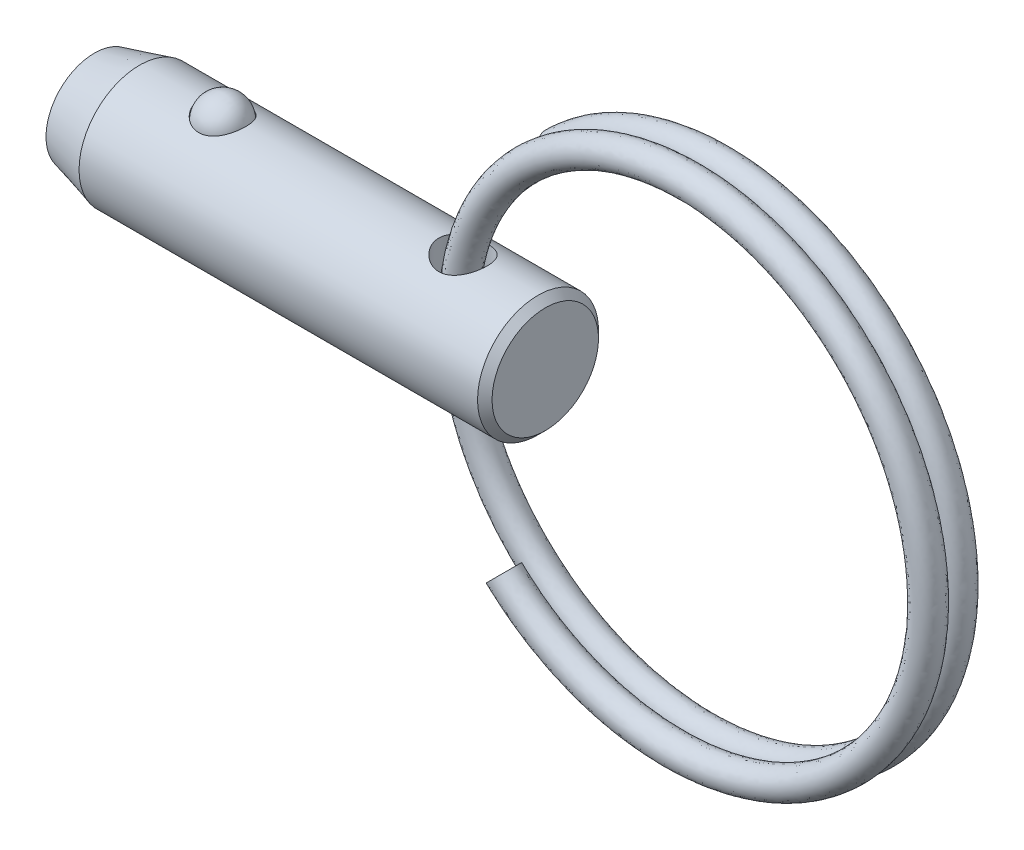
from build123d import *

# Parameters (mm, degrees)
SKETCH4_W          = 1.27
SKETCH4_H          = 6.35
SWEEP1_PITCH       = 1.5494
SWEEP1_HEIGHT      = 1.355725
SWEEP1_RADIUS      = 13.462
SKETCH6_R          = 0.762
SWEEP2_PITCH       = 1.5494
SWEEP2_HEIGHT      = 1.355725
SWEEP2_RADIUS      = 13.462
SWEEP2_START_ANGLE = -180
SKETCH6_2_R        = 0.762


with BuildPart() as part:
    # Sketch1 → Revolve1 (revolve)
    with BuildSketch(Plane.XY, mode=Mode.PRIVATE) as revolve1_sk:
        Polygon((11.8364, 2.794), (11.4554, 3.175), (-9.466547737, 3.175), (-11.8364, 2.54), (-11.8364, 0), (11.8364, 0), align=None)
    revolve(revolve1_sk.sketch.rotate(Axis((11.8364, 0, 0), (1, 0, 0)), 90), axis=Axis((11.8364, 0, 0), (1, 0, 0)))

    # Sketch2 → Cut-Revolve1 (revolve, cut)
    with BuildSketch(Plane.XY):
        with BuildLine():
            Line((-3.844582051, 2.8575), (-6.359182051, 2.8575))
            ThreePointArc((-6.359182051, 2.8575), (-5.101882051, 4.1148), (-3.844582051, 2.8575))
        make_face()
    revolve(axis=Axis((-3.844582051, 2.8575, 0), (1, 0, 0)), mode=Mode.SUBTRACT)

    # Sketch4 → Cut-Revolve2 (revolve, cut)
    with BuildSketch(Plane.XY, mode=Mode.PRIVATE) as cut_revolve2_sk:
        with Locations((8.1534, 0)):
            Rectangle(SKETCH4_W, SKETCH4_H)
    revolve(cut_revolve2_sk.sketch.rotate(Axis((7.5184, -3.175, 0), (0, 1, 0)), 90), axis=Axis((7.5184, -3.175, 0), (0, 1, 0)), mode=Mode.SUBTRACT)


with BuildPart() as body_2:
    # Sketch3 → Revolve2 (revolve)
    with BuildSketch(Plane.XY):
        with BuildLine():
            Line((-3.869982051, 2.8575), (-6.333782051, 2.8575))
            ThreePointArc((-6.333782051, 2.8575), (-5.101882051, 4.0894), (-3.869982051, 2.8575))
        make_face()
    revolve(axis=Axis((-3.869982051, 2.8575, 0), (1, 0, 0)))


with BuildPart() as body_3:
    # Sweep1: sweep along a helix
    with BuildLine() as sweep1_path:
        Helix(SWEEP1_PITCH, SWEEP1_HEIGHT, SWEEP1_RADIUS, center=(20.003425091, 0, 0), direction=(0, 0, -1), lefthand=True)
    # Sketch6 → Sweep1 (sweep)
    with BuildSketch(Plane(origin=(114.003847968, 0, 0), x_dir=(0, 0, -1), z_dir=(0, 1, 0))):
        with Locations((0, 106.700422877)):
            Circle(SKETCH6_R)
    sweep(path=sweep1_path.line, is_frenet=True)

    # Sweep2: sweep along a helix
    with BuildLine() as sweep2_path:
        add(Helix(SWEEP2_PITCH, SWEEP2_HEIGHT, SWEEP2_RADIUS, center=(20.003425091, 0, 0), direction=(0, 0, 1), lefthand=True, mode=Mode.PRIVATE).rotate(Axis((20.003425091, 0, 0), (0, 0, 1)), SWEEP2_START_ANGLE))
    # Sketch6<2> → Sweep2 (sweep)
    with BuildSketch(Plane(origin=(114.003847968, 0, 0), x_dir=(0, 0, -1), z_dir=(0, 1, 0))):
        with Locations((0, 106.700422877)):
            Circle(SKETCH6_2_R)
    sweep(path=sweep2_path.line, is_frenet=True)


solid = Compound([part.part, body_2.part, body_3.part])
